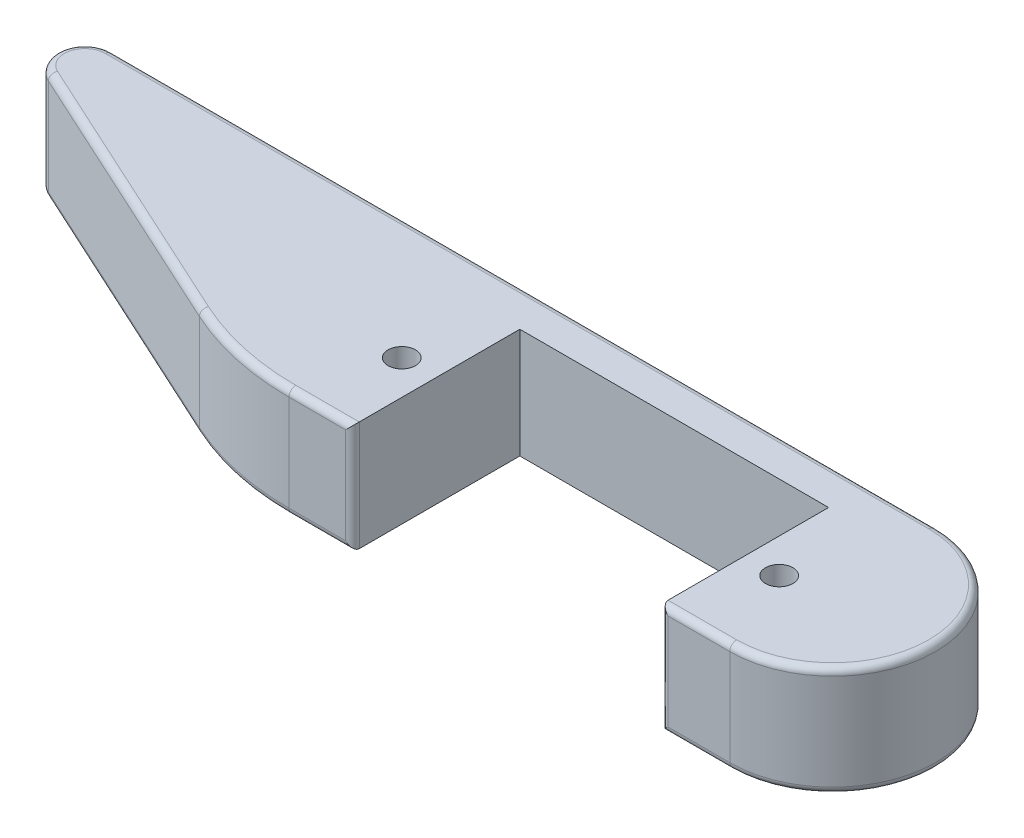
from build123d import *

# Parameters (mm, degrees)
SKETCH_1_R      = 1
EXTRUDE_1_DEPTH = 8
FILLET_3_R      = 0.5


with BuildPart() as part:
    # 草圖1 → 填料-伸長1 (new body)
    with BuildSketch(Plane(origin=(0, 0, 0), x_dir=(1, 0, 0), z_dir=(0, 1, 0))):
        with BuildLine():
            Line((0, 0), (0, 12.2))
            Line((0, 12.2), (-22.5, 12.2))
            Line((-22.5, 12.2), (-22.5, 0))
            Line((-22.5, 0), (-27.124303732, 0))
            ThreePointArc((-27.124303732, 0), (-31.398520886, 0.462060812), (-35.475243216, 1.826893228))
            Line((-35.475243216, 1.826893228), (-55.835093948, 11.182689323))
            ThreePointArc((-55.835093948, 11.182689323), (-56.953793919, 13.427421715), (-55, 15))
            Line((-55, 15), (5, 15))
            ThreePointArc((5, 15), (12.5, 7.5), (5, 0))
            Line((5, 0), (0, 0))
        make_face()
        with Locations(Location((-25, 6.1, 0), (0, 0, 270))):
            Circle(SKETCH_1_R, mode=Mode.SUBTRACT)
        with Locations(Location((2.5, 6.1, 0), (0, 0, 270))):
            Circle(SKETCH_1_R, mode=Mode.SUBTRACT)
    extrude(amount=EXTRUDE_1_DEPTH)

    # 圓角3
    fillet_3_edges = [part.edges().sort_by_distance(p)[0] for p in [
        (-25, 8, -15),
        (-24.812151866, 0, 0),
        (-31.398520886, 0, -0.462060812),
        (-45.655168582, 0, -6.504791275),
        (-56.953793919, 0, -13.427421715),
        (-25, 0, -15),
        (12.5, 0, -7.5),
        (2.5, 0, 0),
        (-56.953793919, 8, -13.427421715),
        (-45.655168582, 8, -6.504791275),
        (0, 4, 0),
        (-22.5, 4, 0),
        (-31.398520886, 8, -0.462060812),
        (-24.812151866, 8, 0),
        (2.5, 8, 0),
        (12.5, 8, -7.5),
    ]]
    fillet(fillet_3_edges, radius=FILLET_3_R)


solid = part.part
